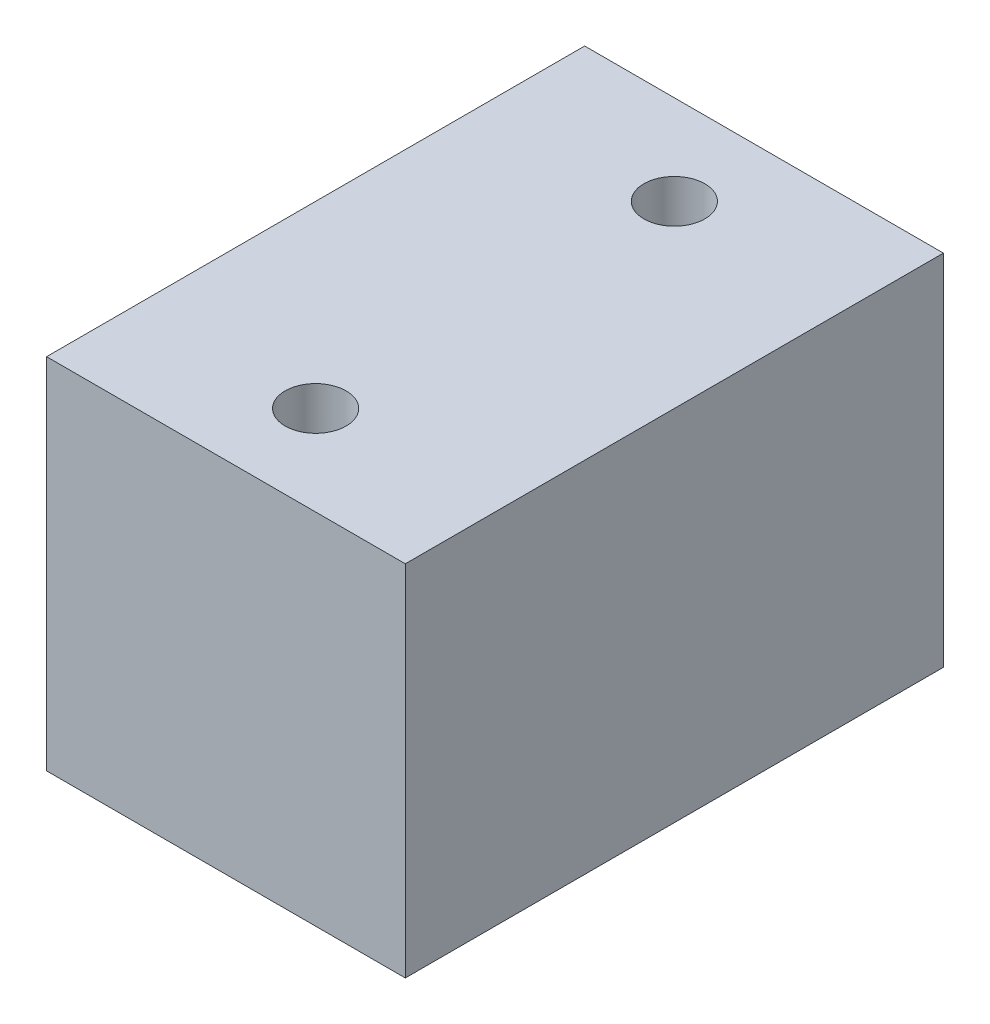
from build123d import *

# Parameters (mm, degrees)
SKETCH_1_W          = 20
SKETCH_1_H          = 20
EXTRUDE_1_DEPTH     = 30
SKETCH_2_R          = 1.7
CUT_EXTRUDE_1_DEPTH = 30


with BuildPart() as part:
    # 草图1 → 凸台-拉伸1 (new body)
    with BuildSketch(Plane.XY):
        Rectangle(SKETCH_1_W, SKETCH_1_H)
    extrude(amount=EXTRUDE_1_DEPTH)

    # 草图2 → 切除-拉伸1 (cut)
    with BuildSketch(Plane(origin=(0, 10, 0), x_dir=(1, 0, 0), z_dir=(0, 1, 0))):
        with Locations(Location((0, -5, 0), (0, 0, 270))):
            Circle(SKETCH_2_R)
        with Locations(Location((0, -25, 0), (0, 0, 270))):
            Circle(SKETCH_2_R)
    extrude(amount=-CUT_EXTRUDE_1_DEPTH, mode=Mode.SUBTRACT)


solid = part.part
